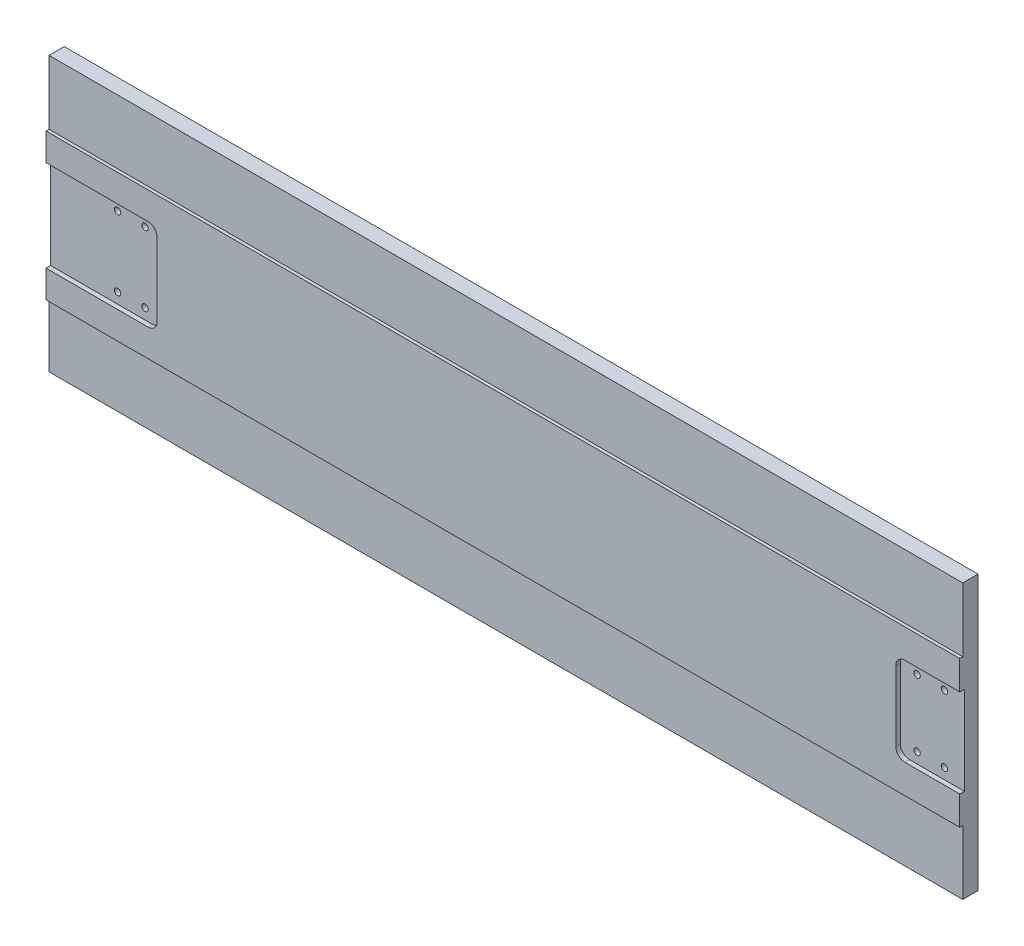
from build123d import *

# Parameters (mm, degrees)
SZKIC1_W                       = 600
SZKIC1_H                       = 180
DODANIE_WYCI_GNI_CIE1_DEPTH    = 10
SZKIC2_W                       = 600
SZKIC2_H                       = 96
DODANIE_WYCI_GNI_CIE2_DEPTH    = 2
SZKIC3_W                       = 42
SZKIC3_H                       = 58
SZKIC3_W_2                     = 73
SZKIC3_H_2                     = 60
WYTNIJ_WYCI_GNI_CIE1_DEPTH     = 3
ZAOKR_GLENIE1_R                = 6
OTW_R_GWINTOWANY_M5X0_82_D     = 4.2
OTW_R_GWINTOWANY_M5X0_83_D     = 4.2
OTW_R_GWINTOWANY_M5X0_83_DEPTH = 17
OTW_R_GWINTOWANY_M5X0_83_TIP   = 1.2618073


with BuildPart() as part:
    # Szkic1 → Dodanie-wyciągnięcie1 (new body)
    with BuildSketch(Plane.XY):
        with Locations((300, 360)):
            Rectangle(SZKIC1_W, SZKIC1_H)
    extrude(amount=DODANIE_WYCI_GNI_CIE1_DEPTH)

    # Szkic2 → Dodanie-wyciągnięcie2 (add)
    with BuildSketch(Plane.XY.offset(10)):
        with Locations((300, 360)):
            Rectangle(SZKIC2_W, SZKIC2_H)
    extrude(amount=DODANIE_WYCI_GNI_CIE2_DEPTH)

    # Szkic3 → Wytnij-wyciągnięcie1 (cut)
    with BuildSketch(Plane.XY.offset(12)):
        with Locations((579, 360)):
            Rectangle(SZKIC3_W, SZKIC3_H)
        with Locations((36.5, 360)):
            Rectangle(SZKIC3_W_2, SZKIC3_H_2)
    extrude(amount=-WYTNIJ_WYCI_GNI_CIE1_DEPTH, mode=Mode.SUBTRACT)

    # Zaokrąglenie1
    zaokr_glenie1_edges = [part.edges().sort_by_distance(p)[0] for p in [
        (73, 390, 10.5),
        (73, 330, 10.5),
        (558, 331, 10.5),
        (558, 389, 10.5),
    ]]
    fillet(zaokr_glenie1_edges, radius=ZAOKR_GLENIE1_R)

    # Otwór gwintowany M5x0.82 (through all)
    with Locations(Plane.XY.offset(9)):
        with Locations((62, 383), (44, 383), (62, 337), (44, 337)):
            Hole(OTW_R_GWINTOWANY_M5X0_82_D / 2)

    # Otwór gwintowany M5x0.83
    with Locations(Plane.XY.offset(9)):
        with Locations((587, 382), (569, 382), (569, 338), (587, 338)):
            Hole(OTW_R_GWINTOWANY_M5X0_83_D / 2, depth=OTW_R_GWINTOWANY_M5X0_83_DEPTH)
            with Locations((0, 0, -(OTW_R_GWINTOWANY_M5X0_83_DEPTH + OTW_R_GWINTOWANY_M5X0_83_TIP / 2))):  # 118° drill point
                Cone(0, OTW_R_GWINTOWANY_M5X0_83_D / 2, OTW_R_GWINTOWANY_M5X0_83_TIP, mode=Mode.SUBTRACT)


solid = part.part
